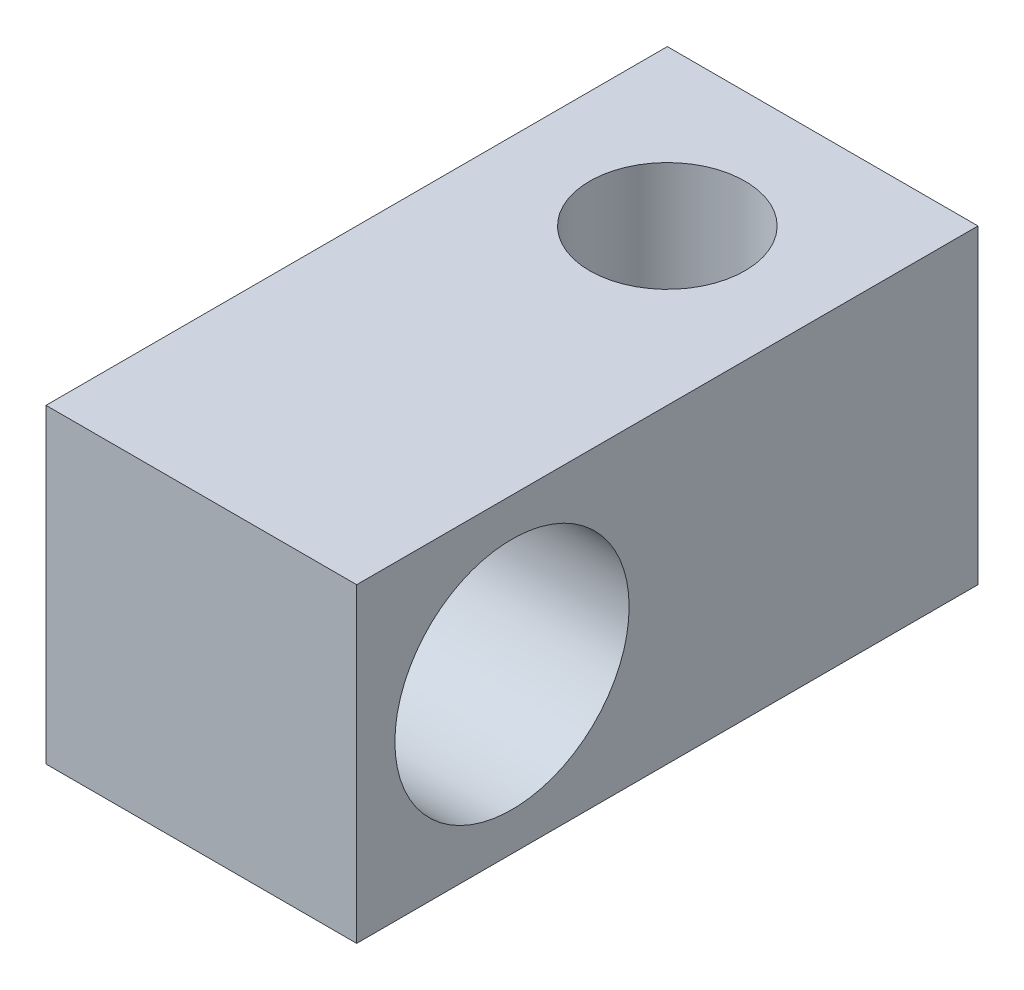
from build123d import *

# Parameters (mm, degrees)
SZKIC1_W                    = 50
SZKIC1_H                    = 50
DODANIE_WYCI_GNI_CIE1_DEPTH = 100
WYTNIJ_WYCI_GNI_CIE1_REACH  = 124.474
SZKIC2_R                    = 12.5
WYTNIJ_WYCI_GNI_CIE2_REACH  = 124.474
SZKIC3_R                    = 18.85


with BuildPart() as part:
    # Szkic1 → Dodanie-wyciągnięcie1 (new body)
    with BuildSketch(Plane.XY):
        with Locations((25, 25)):
            Rectangle(SZKIC1_W, SZKIC1_H)
    extrude(amount=DODANIE_WYCI_GNI_CIE1_DEPTH)

    # Szkic2 → Wytnij-wyciągnięcie1 (cut, up to next)
    with BuildSketch(Plane(origin=(0, 50, 0), x_dir=(1, 0, 0), z_dir=(0, 1, 0)), mode=Mode.PRIVATE) as wytnij_wyci_gni_cie1_sk1:
        with Locations(Location((25, -25, 0), (0, 0, 270))):
            Circle(SZKIC2_R)
    wytnij_wyci_gni_cie1_tool1 = extrude(wytnij_wyci_gni_cie1_sk1.sketch, amount=-WYTNIJ_WYCI_GNI_CIE1_REACH, mode=Mode.PRIVATE) & part.part
    add(wytnij_wyci_gni_cie1_tool1.solids().sort_by_distance((25, 50, 25))[0], mode=Mode.SUBTRACT)

    # Szkic3 → Wytnij-wyciągnięcie2 (cut, up to next)
    with BuildSketch(Plane.ZY, mode=Mode.PRIVATE) as wytnij_wyci_gni_cie2_sk1:
        with Locations((75, 25)):
            Circle(SZKIC3_R)
    wytnij_wyci_gni_cie2_tool1 = extrude(wytnij_wyci_gni_cie2_sk1.sketch, amount=-WYTNIJ_WYCI_GNI_CIE2_REACH, mode=Mode.PRIVATE) & part.part
    add(wytnij_wyci_gni_cie2_tool1.solids().sort_by_distance((0, 25, 75))[0], mode=Mode.SUBTRACT)


solid = part.part
